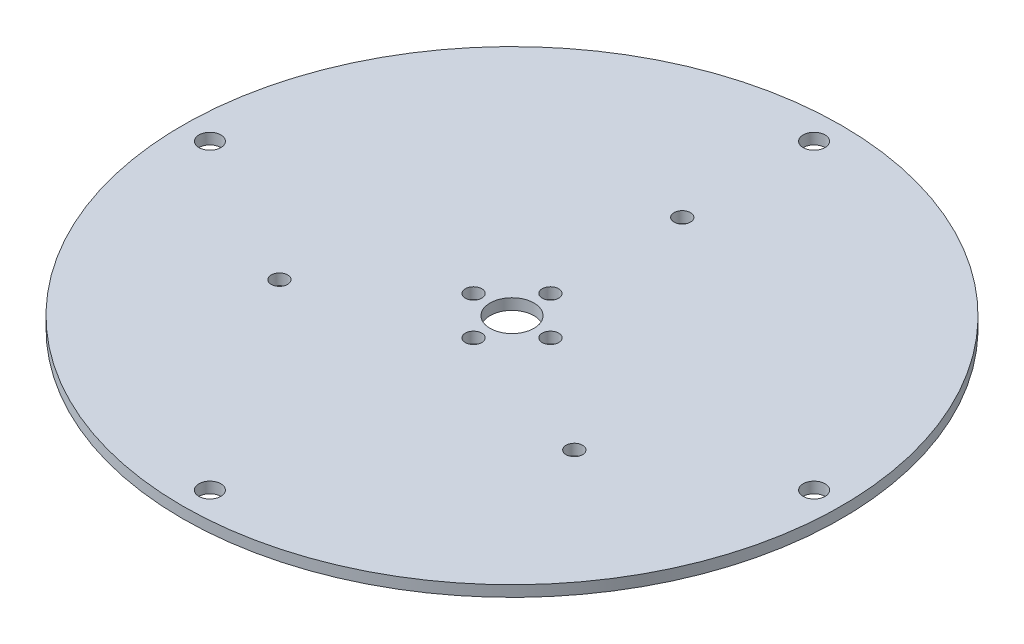
from build123d import *

# Parameters (mm, degrees)
SKETCH_1_R          = 60
SKETCH_1_R_2        = 1.5
EXTRUDE_1_DEPTH     = 2
SKETCH_2_R          = 4
SKETCH_2_R_2        = 1.5
CUT_EXTRUDE_1_DEPTH = 2
SKETCH_3_R          = 2
CUT_EXTRUDE_2_DEPTH = 10


with BuildPart() as part:
    # 草图1 → 凸台-拉伸1 (new body)
    with BuildSketch(Plane(origin=(0, 0, 0), x_dir=(1, 0, 0), z_dir=(0, 1, 0))):
        with Locations(Location((0, 0, 0), (0, 0, 270))):
            Circle(SKETCH_1_R)
        with Locations(Location((0, 31, 0), (0, 0, 270))):
            Circle(SKETCH_1_R_2, mode=Mode.SUBTRACT)
        with Locations(Location((26.846787517, -15.5, 0), (0, 0, 270))):
            Circle(SKETCH_1_R_2, mode=Mode.SUBTRACT)
        with Locations(Location((-26.846787517, -15.5, 0), (0, 0, 270))):
            Circle(SKETCH_1_R_2, mode=Mode.SUBTRACT)
    extrude(amount=EXTRUDE_1_DEPTH)

    # 草图2 → 切除-拉伸1 (cut)
    with BuildSketch(Plane(origin=(0, 2, 0), x_dir=(1, 0, 0), z_dir=(0, 1, 0))):
        with Locations(Location((0, 0, 0), (0, 0, 270))):
            Circle(SKETCH_2_R)
        with Locations(Location((0, 7, 0), (0, 0, 270))):
            Circle(SKETCH_2_R_2)
        with Locations(Location((7, 0, 0), (0, 0, 270))):
            Circle(SKETCH_2_R_2)
        with Locations(Location((0, -7, 0), (0, 0, 270))):
            Circle(SKETCH_2_R_2)
        with Locations(Location((-7, 0, 0), (0, 0, 270))):
            Circle(SKETCH_2_R_2)
    extrude(amount=-CUT_EXTRUDE_1_DEPTH, mode=Mode.SUBTRACT)

    # 草图3 → 切除-拉伸2 (cut)
    with BuildSketch(Plane(origin=(0, 2, 0), x_dir=(1, 0, 0), z_dir=(0, 1, 0))):
        with Locations(Location((0, 55, 0), (0, 0, 270))):
            Circle(SKETCH_3_R)
        with Locations(Location((55, 0, 0), (0, 0, 270))):
            Circle(SKETCH_3_R)
        with Locations(Location((0, -55, 0), (0, 0, 270))):
            Circle(SKETCH_3_R)
        with Locations(Location((-55, 0, 0), (0, 0, 270))):
            Circle(SKETCH_3_R)
    extrude(amount=-CUT_EXTRUDE_2_DEPTH, mode=Mode.SUBTRACT)


solid = part.part
